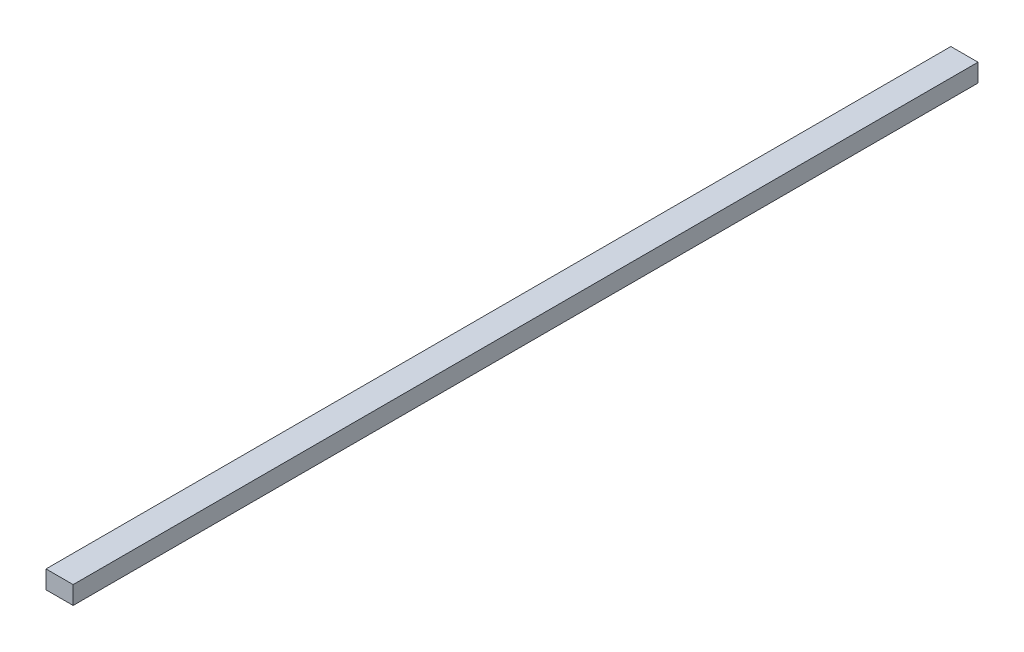
from build123d import *

# Parameters (mm, degrees)
SKETCH1_W           = 12
SKETCH1_H           = 400
BOSS_EXTRUDE1_DEPTH = 8


with BuildPart() as part:
    # Sketch1 → Boss-Extrude1 (new body)
    with BuildSketch(Plane(origin=(0, 0, 0), x_dir=(1, 0, 0), z_dir=(0, 1, 0))):
        with Locations((6, 200)):
            Rectangle(SKETCH1_W, SKETCH1_H)
    extrude(amount=BOSS_EXTRUDE1_DEPTH)


solid = part.part
